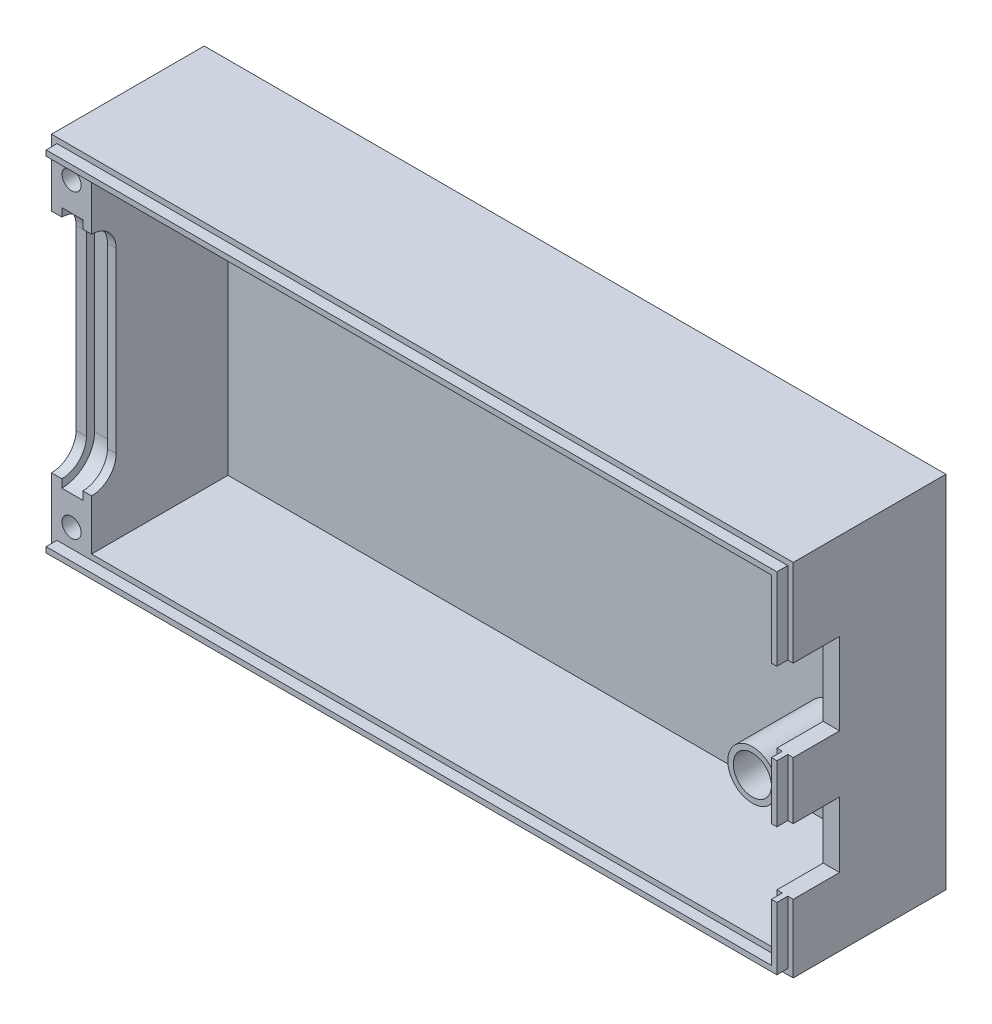
from build123d import *

# Parameters (mm, degrees)
SZKIC1_W                    = 130
SZKIC1_H                    = 60
DODANIE_WYCI_GNI_CIE1_DEPTH = 25
SKORUPA1_T                  = 3
SZKIC3_W                    = 25
SZKIC3_H                    = 60
WYTNIJ_WYCI_GNI_CIE1_DEPTH  = 1.1
DODANIE_WYCI_GNI_CIE2_DEPTH = 3.85
DODANIE_WYCI_GNI_CIE3_DEPTH = 1.6
WYTNIJ_WYCI_GNI_CIE2_DEPTH  = 141.345324112
SZKIC8_R                    = 1.75
DODANIE_WYCI_GNI_CIE4_DEPTH = 25
SZKIC8_2_R                  = 1.75
WYTNIJ_WYCI_GNI_CIE3_DEPTH  = 10
DODANIE_WYCI_GNI_CIE5_START = 5
SZKIC9_R                    = 1.75
DODANIE_WYCI_GNI_CIE5_DEPTH = 5
DODANIE_WYCI_GNI_CIE6_DEPTH = 2
SZKIC11_W                   = 9
SZKIC11_H                   = 9.5
WYTNIJ_WYCI_GNI_CIE4_DEPTH  = 10.5
WYTNIJ_WYCI_GNI_CIE5_REACH  = 144.527
SZKIC15_W                   = 15
SZKIC15_H                   = 12
SZKIC15_H_2                 = 15
SZKIC16_R                   = 3.5
WYTNIJ_WYCI_GNI_CIE6_DEPTH  = 7.35
SZKIC17_R                   = 4.5
SZKIC17_R_2                 = 3.5
SZKIC17_R_3                 = 1.75
DODANIE_WYCI_GNI_CIE7_DEPTH = 14.5


with BuildPart() as part:
    # Szkic1 → Dodanie-wyciągnięcie1 (new body)
    with BuildSketch(Plane.XY):
        Rectangle(SZKIC1_W, SZKIC1_H)
    extrude(amount=DODANIE_WYCI_GNI_CIE1_DEPTH)

    # Skorupa1
    skorupa1_openings = [part.faces().sort_by_distance(p)[0] for p in [
        (0, 0, 25),
    ]]
    offset(amount=SKORUPA1_T, openings=skorupa1_openings, kind=Kind.INTERSECTION)

    # Szkic3 → Wytnij-wyciągnięcie1 (cut)
    with BuildSketch(Plane(origin=(-65, 0, 0), x_dir=(0, 0, -1), z_dir=(1, 0, 0))):
        with Locations((-12.5, 0)):
            Rectangle(SZKIC3_W, SZKIC3_H)
    extrude(amount=-WYTNIJ_WYCI_GNI_CIE1_DEPTH, mode=Mode.SUBTRACT)

    # Szkic4 → Dodanie-wyciągnięcie2 (add)
    with BuildSketch(Plane(origin=(-66.1, 0, 0), x_dir=(0, 0, -1), z_dir=(1, 0, 0))):
        with BuildLine():
            Line((0, 30), (-25, 30))
            Line((-25, 30), (-25, 22.275))
            ThreePointArc((-25, 22.275), (-20.757359313, 20.517640687), (-19, 16.275))
            Line((-19, 16.275), (-19, -16.275))
            ThreePointArc((-19, -16.275), (-20.757359313, -20.517640687), (-25, -22.275))
            Line((-25, -22.275), (-25, -30))
            Line((-25, -30), (0, -30))
            Line((0, -30), (0, 30))
        make_face()
    extrude(amount=DODANIE_WYCI_GNI_CIE2_DEPTH)

    # Szkic5 → Dodanie-wyciągnięcie3 (add)
    with BuildSketch(Plane(origin=(-62.25, 0, 0), x_dir=(0, 0, -1), z_dir=(1, 0, 0))):
        with BuildLine():
            ThreePointArc((-25, 20.775), (-21.818019485, 19.456980515), (-20.5, 16.275))
            Line((-20.5, 16.275), (-20.5, -16.275))
            ThreePointArc((-20.5, -16.275), (-21.818019485, -19.456980515), (-25, -20.775))
            Line((-25, -20.775), (-25, -30))
            Line((-25, -30), (0, -30))
            Line((0, -30), (0, 30))
            Line((0, 30), (-25, 30))
            Line((-25, 30), (-25, 20.775))
        make_face()
    extrude(amount=DODANIE_WYCI_GNI_CIE3_DEPTH)

    # Szkic6 → Wytnij-wyciągnięcie2 (cut, through all)
    with BuildSketch(Plane(origin=(-66.1, 0, 0), x_dir=(0, 0, -1), z_dir=(1, 0, 0))):
        with BuildLine():
            Line((-20.5, -16.275), (-20.5, 16.275))
            ThreePointArc((-20.5, 16.275), (-21.818019485, 19.456980515), (-25, 20.775))
            Line((-25, 20.775), (-25, -20.775))
            ThreePointArc((-25, -20.775), (-21.818019485, -19.456980515), (-20.5, -16.275))
        make_face()
    extrude(amount=-WYTNIJ_WYCI_GNI_CIE2_DEPTH, mode=Mode.SUBTRACT)

    # Szkic8 → Dodanie-wyciągnięcie4 (add)
    # profile 1 of 3: a face of its own
    with BuildSketch(Plane.XY.offset(25)):
        with Locations((-64.325, 27.5875)):
            Circle(SZKIC8_R)
    # profile 2 of 3: a face of its own
    with BuildSketch(Plane.XY.offset(25)):
        with Locations((-64.325, -27.5875)):
            Circle(SZKIC8_R)
    # profile 3 of 3: a face of its own
    with BuildSketch(Plane.XY.offset(25)):
        with BuildLine():
            Line((-19.15, 25), (-19.15, 30))
            Line((-19.15, 30), (-10.15, 30))
            Line((-10.15, 30), (-10.15, 25))
            ThreePointArc((-10.15, 25), (-14.65, 20.5), (-19.15, 25))
        make_face()
        with Locations((-14.65, 25)):
            Circle(SZKIC8_R, mode=Mode.SUBTRACT)
    extrude(amount=-DODANIE_WYCI_GNI_CIE4_DEPTH)

    # Szkic8<2> → Wytnij-wyciągnięcie3 (cut)
    with BuildSketch(Plane.XY.offset(25)):
        with Locations((-64.325, 27.5875)):
            Circle(SZKIC8_2_R)
        with Locations((-64.325, -27.5875)):
            Circle(SZKIC8_2_R)
    extrude(amount=-WYTNIJ_WYCI_GNI_CIE3_DEPTH, mode=Mode.SUBTRACT)

    # Szkic9 → Dodanie-wyciągnięcie5 (add)
    with BuildSketch(Plane.XY.offset(DODANIE_WYCI_GNI_CIE5_START)):
        with Locations((-14.65, 25)):
            Circle(SZKIC9_R)
    extrude(amount=-DODANIE_WYCI_GNI_CIE5_DEPTH)

    # Szkic10 → Dodanie-wyciągnięcie6 (add)
    with BuildSketch(Plane.XY.offset(25)):
        Polygon((-61.65, 31), (-67, 31), (-67, 32), (67, 32), (67, -32), (-67, -32), (-67, -31), (-61.65, -31), (66, -31), (66, 31), (-11.15, 31), (-18.15, 31), align=None)
    extrude(amount=DODANIE_WYCI_GNI_CIE6_DEPTH)

    # Szkic11 → Wytnij-wyciągnięcie4 (cut)
    with BuildSketch(Plane.XY.offset(25)):
        with Locations((-14.65, 25.25)):
            Rectangle(SZKIC11_W, SZKIC11_H)
    extrude(amount=-WYTNIJ_WYCI_GNI_CIE4_DEPTH, mode=Mode.SUBTRACT)

    # Szkic15 → Wytnij-wyciągnięcie5 (cut, up to next)
    with BuildSketch(Plane(origin=(68, 0, 0), x_dir=(0, 0, -1), z_dir=(1, 0, 0)), mode=Mode.PRIVATE) as wytnij_wyci_gni_cie5_sk1:
        with Locations((-24, -14.5)):
            Rectangle(SZKIC15_W, SZKIC15_H)
    wytnij_wyci_gni_cie5_tool1 = extrude(wytnij_wyci_gni_cie5_sk1.sketch, amount=-WYTNIJ_WYCI_GNI_CIE5_REACH, mode=Mode.PRIVATE) & part.part
    # Szkic15 → Wytnij-wyciągnięcie5 (cut, up to next)
    with BuildSketch(Plane(origin=(68, 0, 0), x_dir=(0, 0, -1), z_dir=(1, 0, 0)), mode=Mode.PRIVATE) as wytnij_wyci_gni_cie5_sk2:
        with Locations((-24, 9.5)):
            Rectangle(SZKIC15_W, SZKIC15_H_2)
    wytnij_wyci_gni_cie5_tool2 = extrude(wytnij_wyci_gni_cie5_sk2.sketch, amount=-WYTNIJ_WYCI_GNI_CIE5_REACH, mode=Mode.PRIVATE) & part.part
    add(wytnij_wyci_gni_cie5_tool1.solids().sort_by_distance((68, -14.5, 24))[0], mode=Mode.SUBTRACT)
    add(wytnij_wyci_gni_cie5_tool2.solids().sort_by_distance((68, 9.5, 24))[0], mode=Mode.SUBTRACT)

    # Szkic16 → Wytnij-wyciągnięcie6 (cut)
    with BuildSketch(Plane.ZY.offset(68)):
        with Locations((5, 25)):
            Circle(SZKIC16_R)
    extrude(amount=-WYTNIJ_WYCI_GNI_CIE6_DEPTH, mode=Mode.SUBTRACT)

    # Szkic17 → Dodanie-wyciągnięcie7 (add)
    # profile 1 of 2: a face of its own
    with BuildSketch(Plane.XY):
        with Locations((50, -15)):
            Circle(SZKIC17_R)
        with Locations((50, -15)):
            Circle(SZKIC17_R_2, mode=Mode.SUBTRACT)
    # profile 2 of 2: a face of its own
    with BuildSketch(Plane.XY):
        with BuildLine():
            Line((52, 27), (52, 30))
            Line((52, 30), (58, 30))
            Line((58, 30), (58, 27))
            ThreePointArc((58, 27), (55, 24), (52, 27))
        make_face()
        with Locations((55, 27)):
            Circle(SZKIC17_R_3, mode=Mode.SUBTRACT)
    extrude(amount=DODANIE_WYCI_GNI_CIE7_DEPTH)


solid = part.part
